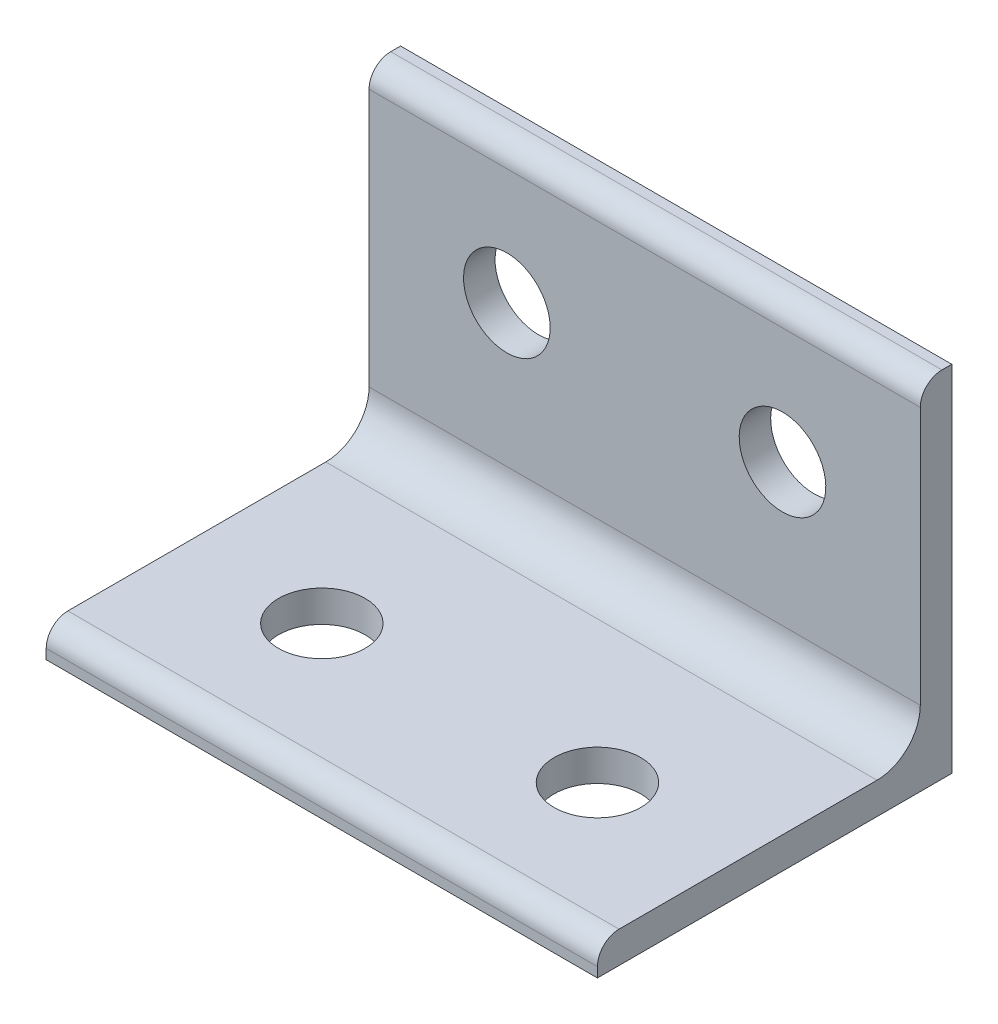
from build123d import *

# Parameters (mm, degrees)
ANGLES_EQUAL_90_X_90_X_8_1_DEPTH = 140
SKETCH12_R                       = 11
CUT_EXTRUDE1_DEPTH               = 190.208879284
LPATTERN1_COUNT                  = 2
LPATTERN1_PITCH                  = 70
CIRPATTERN4_COUNT                = 2
CIRPATTERN4_ANGLE                = 90
CIRPATTERN4_COPY_1_SKETCH_R      = 11
CIRPATTERN4_COPY_1_DEPTH         = 190.208879284


with BuildPart() as part:
    # Sketch11 → Angles equal 90 X 90 X 8(1) (new body)
    with BuildSketch(Plane(origin=(0, 45, 45), x_dir=(0, 1, 0), z_dir=(1, 0, 0))):
        with BuildLine():
            Line((-45, 45), (-45, -45))
            Line((-45, -45), (45, -45))
            Line((45, -45), (45, -42.5))
            ThreePointArc((45, -42.5), (43.389087297, -38.610912703), (39.5, -37))
            Line((39.5, -37), (-26, -37))
            ThreePointArc((-26, -37), (-33.778174593, -33.778174593), (-37, -26))
            Line((-37, -26), (-37, 39.5))
            ThreePointArc((-37, 39.5), (-38.610912703, 43.389087297), (-42.5, 45))
            Line((-42.5, 45), (-45, 45))
        make_face()
    extrude(amount=ANGLES_EQUAL_90_X_90_X_8_1_DEPTH)

    # Sketch12 → Cut-Extrude1 (cut, symmetric)
    with BuildSketch(Plane(origin=(0, 0, 0), x_dir=(1, 0, 0), z_dir=(0, 1, 0))):
        with Locations(Location((35, -55, 0), (0, 0, 90))):
            Circle(SKETCH12_R)
    cut_extrude1 = extrude(amount=CUT_EXTRUDE1_DEPTH, both=True, mode=Mode.SUBTRACT)

    # LPattern1: Cut-Extrude1 ×2
    with Locations(*[(i * LPATTERN1_PITCH, 0, 0) for i in range(1, LPATTERN1_COUNT)]):
        add(cut_extrude1, mode=Mode.SUBTRACT)

    # CirPattern4: Cut-Extrude1 ×2 about axis
    cirpattern4_axis = Axis((-18.99, 0, 0), (-1, 0, 0))
    for i in range(1, CIRPATTERN4_COUNT):
        add(cut_extrude1.rotate(cirpattern4_axis, i * CIRPATTERN4_ANGLE / (CIRPATTERN4_COUNT - 1)), mode=Mode.SUBTRACT)

    # CirPattern4 copy 1 sketch → CirPattern4 copy 1 (cut, symmetric)
    with BuildSketch(Plane(origin=(70, 0, 0), x_dir=(1, 0, 0), z_dir=(0, 0, -1))):
        with Locations(Location((35, -55, 0), (0, 0, 90))):
            Circle(CIRPATTERN4_COPY_1_SKETCH_R)
    extrude(amount=CIRPATTERN4_COPY_1_DEPTH, both=True, mode=Mode.SUBTRACT)


solid = part.part
